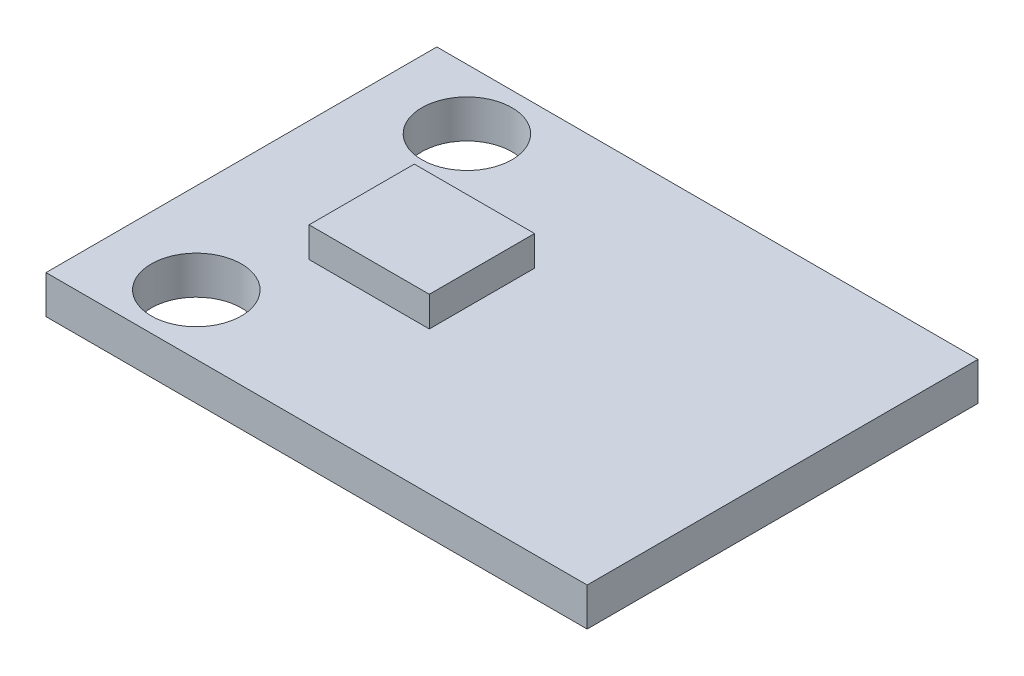
from build123d import *

# Parameters (mm, degrees)
SKETCH1_W           = 18
SKETCH1_H           = 13
BOSS_EXTRUDE1_DEPTH = 1.27
CUT_EXTRUDE1_REACH  = 13.174
SKETCH2_R           = 1.5
CUT_EXTRUDE2_REACH  = 13.174
SKETCH3_R           = 1.5
SKETCH4_W           = 4
SKETCH4_H           = 3.5
BOSS_EXTRUDE2_DEPTH = 1


with BuildPart() as part:
    # Sketch1 → Boss-Extrude1 (new body)
    with BuildSketch(Plane(origin=(0, 0, 0), x_dir=(1, 0, 0), z_dir=(0, 1, 0))):
        Rectangle(SKETCH1_W, SKETCH1_H)
    extrude(amount=BOSS_EXTRUDE1_DEPTH)

    # Sketch2 → Cut-Extrude1 (cut, up to next)
    with BuildSketch(Plane(origin=(0, 1.27, 0), x_dir=(1, 0, 0), z_dir=(0, 1, 0)), mode=Mode.PRIVATE) as cut_extrude1_sk1:
        with Locations(Location((-6, 4.5, 0), (0, 0, 270))):
            Circle(SKETCH2_R)
    cut_extrude1_tool1 = extrude(cut_extrude1_sk1.sketch, amount=-CUT_EXTRUDE1_REACH, mode=Mode.PRIVATE) & part.part
    add(cut_extrude1_tool1.solids().sort_by_distance((-6, 1.27, -4.5))[0], mode=Mode.SUBTRACT)

    # Sketch3 → Cut-Extrude2 (cut, up to next)
    with BuildSketch(Plane(origin=(0, 1.27, 0), x_dir=(1, 0, 0), z_dir=(0, 1, 0)), mode=Mode.PRIVATE) as cut_extrude2_sk1:
        with Locations(Location((-6, -4.5, 0), (0, 0, 270))):
            Circle(SKETCH3_R)
    cut_extrude2_tool1 = extrude(cut_extrude2_sk1.sketch, amount=-CUT_EXTRUDE2_REACH, mode=Mode.PRIVATE) & part.part
    add(cut_extrude2_tool1.solids().sort_by_distance((-6, 1.27, 4.5))[0], mode=Mode.SUBTRACT)

    # Sketch4 → Boss-Extrude2 (add)
    with BuildSketch(Plane(origin=(0, 1.27, 0), x_dir=(1, 0, 0), z_dir=(0, 1, 0))):
        with Locations((-3, 0)):
            Rectangle(SKETCH4_W, SKETCH4_H)
    extrude(amount=BOSS_EXTRUDE2_DEPTH)


solid = part.part
